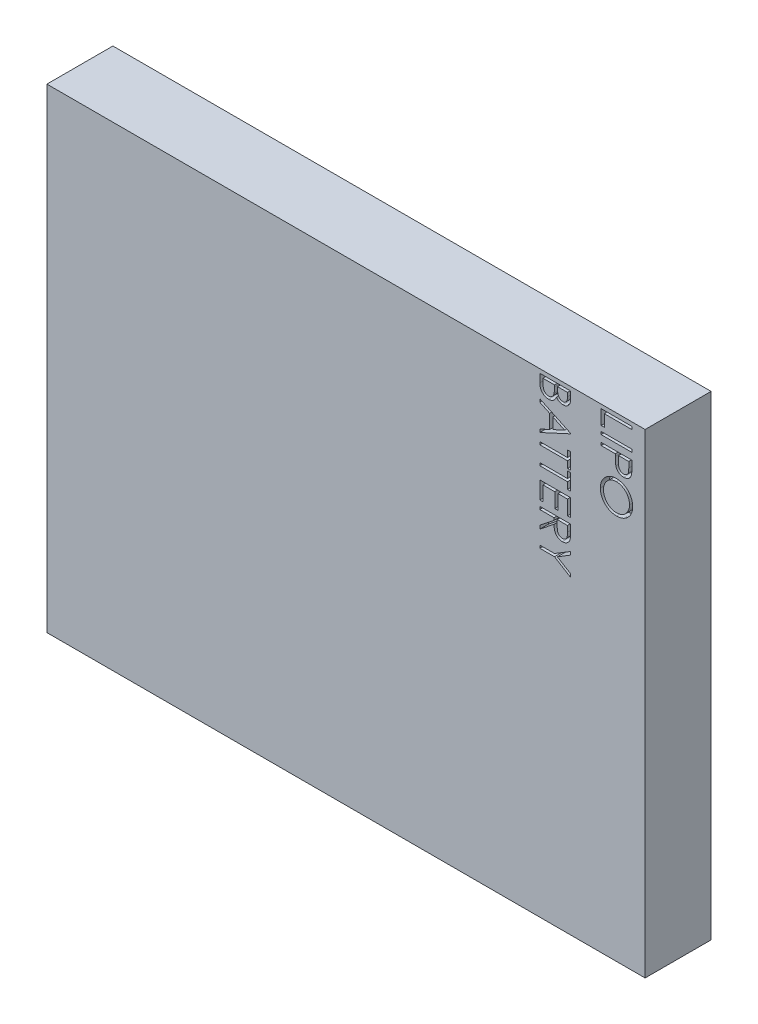
from build123d import *

# Parameters (mm, degrees)
SKETCH1_W           = 68
SKETCH1_H           = 54
BOSS_EXTRUDE1_DEPTH = 7.5
SKETCH2_W           = 3.5
SKETCH2_H           = 0.314102564
CUT_EXTRUDE1_DEPTH  = 1


with BuildPart() as part:
    # Sketch1 → Boss-Extrude1 (new body)
    with BuildSketch(Plane.XY):
        Rectangle(SKETCH1_W, SKETCH1_H)
    extrude(amount=BOSS_EXTRUDE1_DEPTH)

    # Sketch2 → Cut-Extrude1 (cut)
    # profile 1 of 11: a face of its own
    with BuildSketch(Plane.XY.offset(7.5)):
        Polygon((32.5, 26.551282051), (32.5, 26.237179487), (29.358974359, 26.237179487), (29.358974359, 24.891025641), (29, 24.891025641), (29, 26.551282051), align=None)
    # profile 2 of 11: a face of its own
    with BuildSketch(Plane.XY.offset(7.5)):
        with Locations((30.75, 24.150641026)):
            Rectangle(SKETCH2_W, SKETCH2_H)
    # profile 3 of 11: a face of its own
    with BuildSketch(Plane.XY.offset(7.5)):
        with BuildLine():
            Line((32.5, 23.230769231), (32.5, 22.544370994))
            add(Edge.make_bspline(
                [(32.5, 22.544370994), (32.499948104, 22.497160087), (32.499848668, 22.406701895), (32.496833922, 22.276986839), (32.49280723, 22.159177107), (32.487225337, 22.053526726), (32.480628747, 21.959710628), (32.471376708, 21.878153329), (32.461716412, 21.808213772), (32.451895005, 21.766307323), (32.447415865, 21.747195513)],
                knots=[0, 0, 0, 0, 1.415646017, 2.712440637, 3.8905458, 4.950247383, 5.884950622, 6.709939814, 7.411656543, 8, 8, 8, 8], degree=3))
            add(Edge.make_bspline(
                [(32.447415865, 21.747195513), (32.440793975, 21.723001922), (32.42770623, 21.675184832), (32.401491651, 21.606284615), (32.370412659, 21.540727702), (32.334976989, 21.478307484), (32.293734792, 21.419723476), (32.247990678, 21.364225765), (32.197769812, 21.311496032), (32.142098627, 21.26332549), (32.083029703, 21.218978321), (32.019247543, 21.180935178), (31.952140341, 21.148755701), (31.881020836, 21.122474869), (31.806321276, 21.1024913), (31.727823588, 21.087726807), (31.645797497, 21.078280302), (31.589736435, 21.077380918), (31.561197917, 21.076923077)],
                knots=[0, 0, 0, 0, 0.999487232, 1.975422798, 2.933948774, 3.889618007, 4.832992075, 5.786114792, 6.754729845, 7.731954186, 8.717668599, 9.695514499, 10.68728626, 11.680675814, 12.71351902, 13.766008651, 14.862761406, 16, 16, 16, 16], degree=3))
            add(Edge.make_bspline(
                [(31.561197917, 21.076923077), (31.53242014, 21.077344502), (31.476114476, 21.078169048), (31.393741688, 21.088065333), (31.315023298, 21.101395525), (31.240133847, 21.121892577), (31.169518077, 21.14873825), (31.102096845, 21.180230303), (31.039017173, 21.218213833), (30.980050055, 21.261858663), (30.925140143, 21.310410257), (30.874685348, 21.363663195), (30.82898101, 21.421402488), (30.787924666, 21.483444636), (30.752468387, 21.550394485), (30.720711082, 21.621236638), (30.694040021, 21.696586855), (30.68000996, 21.748729369), (30.672876603, 21.775240385)],
                knots=[0, 0, 0, 0, 1.121902311, 2.195077645, 3.232258892, 4.234102512, 5.217864754, 6.176164875, 7.132989551, 8.084763148, 9.034132444, 9.988522005, 10.94243251, 11.903244335, 12.886203696, 13.894208494, 14.929344452, 16, 16, 16, 16], degree=3))
            add(Edge.make_bspline(
                [(30.672876603, 21.775240385), (30.668213621, 21.797167719), (30.657994427, 21.845222746), (30.64658597, 21.924365468), (30.63684837, 22.016510854), (30.629547232, 22.121533134), (30.623296864, 22.239338039), (30.61832877, 22.369989296), (30.615598916, 22.513743373), (30.615458123, 22.614014617), (30.615384615, 22.666366186)],
                knots=[0, 0, 0, 0, 0.601384939, 1.31797006, 2.144135048, 3.087295005, 4.142315834, 5.309527816, 6.595305764, 8, 8, 8, 8], degree=3))
            Line((30.615384615, 22.666366186), (30.615384615, 22.916666667))
            Line((30.615384615, 22.916666667), (29, 22.916666667))
            Line((29, 22.916666667), (29, 23.230769231))
            Line((29, 23.230769231), (32.5, 23.230769231))
        make_face()
        with BuildLine():
            Line((32.141025641, 22.916666667), (30.974358974, 22.916666667))
            Line((30.974358974, 22.916666667), (30.966646635, 22.303886218))
            add(Edge.make_bspline(
                [(30.966646635, 22.303886218), (30.966627924, 22.273966), (30.966591804, 22.216205635), (30.970631709, 22.132540305), (30.975087995, 22.055117307), (30.982066731, 21.983768505), (30.99126187, 21.919039151), (31.001270604, 21.860097819), (31.014830447, 21.807807378), (31.033737491, 21.746532557), (31.065355346, 21.67848546), (31.112432024, 21.604948929), (31.170792088, 21.541618988), (31.237310672, 21.487182148), (31.311578922, 21.444993742), (31.390418136, 21.413262681), (31.473877922, 21.39477952), (31.530961719, 21.392285441), (31.559795673, 21.391025641)],
                knots=[0, 0, 0, 0, 1.160368111, 2.240066715, 3.248291599, 4.168343349, 5.019594299, 5.784185847, 6.485545725, 7.113397927, 8.269509094, 9.383373363, 10.487084095, 11.595623793, 12.704274681, 13.786671823, 14.88201193, 16, 16, 16, 16], degree=3))
            add(Edge.make_bspline(
                [(31.559795673, 21.391025641), (31.587932, 21.392292168), (31.643863535, 21.394809868), (31.725874557, 21.413408474), (31.803877317, 21.444931799), (31.877231232, 21.487468023), (31.943477588, 21.540341808), (32.000520555, 21.602268299), (32.047000556, 21.671982998), (32.076793746, 21.736866185), (32.095014888, 21.794462256), (32.107758306, 21.844495455), (32.117934363, 21.900985737), (32.126173726, 21.963953638), (32.133227231, 22.032910435), (32.138013195, 22.108448761), (32.140814655, 22.190282401), (32.14095361, 22.247092972), (32.141025641, 22.276542468)],
                knots=[0, 0, 0, 0, 1.120550889, 2.227516482, 3.330715807, 4.461473166, 5.594337325, 6.694900473, 7.802844763, 8.919519911, 9.52614448, 10.208195984, 10.975273469, 11.811520316, 12.738076669, 13.736566072, 14.826679847, 16, 16, 16, 16], degree=3))
            Line((32.141025641, 22.276542468), (32.141025641, 22.916666667))
        make_face(mode=Mode.SUBTRACT)
    # profile 4 of 11: a face of its own
    with BuildSketch(Plane.XY.offset(7.5)):
        with BuildLine():
            add(Edge.make_bspline(
                [(32.58974359, 18.721153846), (32.588102095, 18.656345753), (32.584878065, 18.529057312), (32.560199174, 18.341982229), (32.517503005, 18.163387812), (32.460642864, 17.991815197), (32.384777986, 17.829331367), (32.293132169, 17.674658191), (32.184401996, 17.528232989), (32.060411907, 17.391397925), (31.925013874, 17.266640545), (31.780103223, 17.157640882), (31.627664278, 17.06548249), (31.467166593, 16.989946718), (31.299316575, 16.930634605), (31.123159859, 16.889719244), (30.93985391, 16.863580087), (30.814826943, 16.860524448), (30.751402244, 16.858974359)],
                knots=[0, 0, 0, 0, 1.06508495, 2.091914715, 3.094501328, 4.079693967, 5.057647778, 6.035986298, 7.030177474, 8.050107388, 9.066943579, 10.051896531, 11.025616101, 11.9896488, 12.96281505, 13.945825876, 14.957941789, 16, 16, 16, 16], degree=3))
            add(Edge.make_bspline(
                [(30.751402244, 16.858974359), (30.688444743, 16.860524219), (30.564348215, 16.863579172), (30.38220555, 16.889748994), (30.207111995, 16.930786159), (30.039376849, 16.989396523), (29.878760099, 17.064569421), (29.726040956, 17.157350669), (29.580126929, 17.265628684), (29.444071601, 17.389954851), (29.319069137, 17.525320595), (29.209900008, 17.670639884), (29.116606927, 17.822928806), (29.041589249, 17.983329467), (28.981857369, 18.150053666), (28.941093859, 18.324629423), (28.91480978, 18.506277766), (28.911790855, 18.630148523), (28.91025641, 18.693108974)],
                knots=[0, 0, 0, 0, 1.04355943, 2.056976533, 3.044937463, 4.02179873, 4.997890911, 5.980248884, 6.980147982, 8.006253959, 9.032111064, 10.031228745, 11.015595249, 11.988180414, 12.962670953, 13.946861971, 14.95644057, 16, 16, 16, 16], degree=3))
            add(Edge.make_bspline(
                [(28.91025641, 18.693108974), (28.911805589, 18.756533417), (28.914859433, 18.881559878), (28.94104382, 19.065095135), (28.98197419, 19.2413794), (29.040523622, 19.409869896), (29.115907025, 19.570621915), (29.208542033, 19.723619909), (29.317699667, 19.86904773), (29.44186031, 20.005425481), (29.577291109, 20.13005631), (29.721655207, 20.23967632), (29.873579619, 20.331777268), (30.032438084, 20.407192494), (30.197819979, 20.466843066), (30.370765619, 20.507551654), (30.550305895, 20.533886583), (30.672548687, 20.53692157), (30.734575321, 20.538461538)],
                knots=[0, 0, 0, 0, 1.053167129, 2.076072758, 3.073341244, 4.055601477, 5.033424535, 6.017524495, 7.021518915, 8.049444456, 9.077120685, 10.074910483, 11.055688766, 12.022980584, 12.991883888, 13.970269434, 14.970104079, 16, 16, 16, 16], degree=3))
            add(Edge.make_bspline(
                [(30.734575321, 20.538461538), (30.77620818, 20.537927393), (30.858948682, 20.536865841), (30.981812482, 20.524066936), (31.102713633, 20.505532268), (31.221245722, 20.478830238), (31.337428106, 20.444386885), (31.451023186, 20.401941294), (31.562966651, 20.353298631), (31.671128018, 20.295382822), (31.775677054, 20.23219494), (31.875306461, 20.163294905), (31.968236589, 20.088202311), (32.055960675, 20.00798984), (32.136981469, 19.921547171), (32.21306541, 19.830175263), (32.283424907, 19.733396018), (32.346582215, 19.631056376), (32.40459297, 19.525765526), (32.453027176, 19.416759577), (32.49583652, 19.306338444), (32.529857253, 19.193529497), (32.556931155, 19.07859368), (32.575327187, 18.96138731), (32.588154532, 18.842031109), (32.589211625, 18.761619625), (32.58974359, 18.721153846)],
                knots=[0, 0, 0, 0, 1.037115869, 2.061148057, 3.07517727, 4.084041727, 5.086514338, 6.092668487, 7.104487461, 8.125783165, 9.147610153, 10.147694368, 11.141876323, 12.122903372, 13.107606018, 14.091946891, 15.084523921, 16.086505767, 17.087268121, 18.077809654, 19.05670789, 20.036870126, 21.011670792, 21.99694167, 22.991993299, 24, 24, 24, 24], degree=3))
        make_face()
        with BuildLine():
            add(Edge.make_bspline(
                [(32.230769231, 18.705729167), (32.230364533, 18.738943876), (32.229559007, 18.80505576), (32.218940442, 18.903339175), (32.203821283, 19.00033533), (32.182199728, 19.096038945), (32.153011412, 19.189935004), (32.118619208, 19.282961185), (32.078161992, 19.37467081), (32.030987871, 19.464038631), (31.979455267, 19.550915268), (31.922896448, 19.633455302), (31.861585665, 19.710835339), (31.796332792, 19.783303257), (31.726473906, 19.850647883), (31.653123961, 19.914234341), (31.574171398, 19.971503449), (31.491761173, 20.023989154), (31.405999543, 20.07095696), (31.317789694, 20.112722324), (31.226412003, 20.14688633), (31.132857847, 20.174748707), (31.037275387, 20.197848518), (30.938939538, 20.212482442), (30.838344426, 20.223214801), (30.770362572, 20.223974647), (30.735977564, 20.224358974)],
                knots=[0, 0, 0, 0, 1.008585988, 2.007529826, 2.999688727, 3.990042337, 4.984966365, 5.984641633, 7.001812546, 8.027570247, 9.052811818, 10.068991095, 11.064725446, 12.050001529, 13.029093193, 14.010961114, 14.996492974, 15.989185205, 16.977398719, 17.96520407, 18.951579521, 19.937648295, 20.929603947, 21.935788061, 22.955928099, 24, 24, 24, 24], degree=3))
            add(Edge.make_bspline(
                [(30.735977564, 20.224358974), (30.685415343, 20.223084112), (30.585943813, 20.220576065), (30.440175669, 20.198618494), (30.300087383, 20.16479652), (30.166445474, 20.114939154), (30.038101191, 20.052588539), (29.916193086, 19.975561649), (29.800688212, 19.884302563), (29.692392943, 19.780639036), (29.593547138, 19.66731633), (29.50678373, 19.5469836), (29.43337348, 19.420929992), (29.373568408, 19.28882679), (29.32617867, 19.151379251), (29.293700039, 19.0077017), (29.272324583, 18.85875124), (29.270271827, 18.757220585), (29.269230769, 18.705729167)],
                knots=[0, 0, 0, 0, 1.032063989, 2.030389145, 3.003944642, 3.970395727, 4.937377036, 5.913328081, 6.909231446, 7.93887556, 8.970685674, 9.976071282, 10.964166581, 11.944589148, 12.933237628, 13.927779006, 14.949070134, 16, 16, 16, 16], degree=3))
            add(Edge.make_bspline(
                [(29.269230769, 18.705729167), (29.269706272, 18.671119664), (29.270649337, 18.602478626), (29.280148035, 18.500383118), (29.295379827, 18.400126852), (29.317310768, 18.301850773), (29.34475692, 18.205665219), (29.377368571, 18.111173178), (29.418035002, 18.019364487), (29.46303868, 17.929143885), (29.513974143, 17.84276911), (29.569742383, 17.760820437), (29.62995669, 17.683772955), (29.694642917, 17.611459785), (29.76324345, 17.543648535), (29.837522123, 17.482180566), (29.915309656, 17.424225383), (29.997912104, 17.371949837), (30.083854458, 17.325075411), (30.172398435, 17.284315191), (30.263239739, 17.249714052), (30.356532336, 17.2217869), (30.452092907, 17.199901073), (30.550051061, 17.184821252), (30.650210383, 17.174272787), (30.717954242, 17.173477713), (30.752103365, 17.173076923)],
                knots=[0, 0, 0, 0, 1.047226202, 2.076964084, 3.100341814, 4.114585567, 5.122123135, 6.126552355, 7.137064942, 8.158803602, 9.176592812, 10.169297945, 11.156925011, 12.133779169, 13.104132798, 14.073170763, 15.049307625, 16.038276215, 17.028988595, 18.010110019, 18.986169996, 19.968539974, 20.955178716, 21.950601663, 22.966915103, 24, 24, 24, 24], degree=3))
            add(Edge.make_bspline(
                [(30.752103365, 17.173076923), (30.78601887, 17.173478036), (30.85329652, 17.174273718), (30.952757338, 17.184816192), (31.05001055, 17.199917083), (31.144674353, 17.221679791), (31.236772878, 17.249729944), (31.326219625, 17.284317275), (31.413347821, 17.325102574), (31.497942117, 17.371910799), (31.579116856, 17.424526622), (31.656719267, 17.482020865), (31.729292011, 17.545386213), (31.798626696, 17.612812241), (31.863244622, 17.685983115), (31.923167004, 17.764567449), (31.979840805, 17.847610976), (32.030964348, 17.935538789), (32.078186141, 18.026280579), (32.118609301, 18.119402506), (32.153160153, 18.21401278), (32.182080254, 18.309627002), (32.203842466, 18.406918734), (32.218935017, 18.505321407), (32.229560144, 18.605003216), (32.230364923, 18.672047304), (32.230769231, 18.705729167)],
                knots=[0, 0, 0, 0, 1.029967493, 2.04313025, 3.035375922, 4.01889446, 4.991458755, 5.958017022, 6.930036849, 7.912118993, 8.892942568, 9.867138445, 10.843712051, 11.817804417, 12.803729339, 13.806387533, 14.818654169, 15.856205545, 16.894655496, 17.924916651, 18.938004761, 19.953404357, 20.957695443, 21.963967554, 22.97713031, 24, 24, 24, 24], degree=3))
        make_face(mode=Mode.SUBTRACT)
    # profile 5 of 11: a face of its own
    with BuildSketch(Plane.XY.offset(7.5)):
        with BuildLine():
            Line((25.532051282, 26.551282051), (25.532051282, 25.868389423))
            add(Edge.make_bspline(
                [(25.532051282, 25.868389423), (25.531875532, 25.834960945), (25.531534884, 25.770168235), (25.526251752, 25.675948793), (25.519048083, 25.587699982), (25.50761799, 25.50539621), (25.493826213, 25.429075507), (25.477124397, 25.35850787), (25.457097783, 25.293917698), (25.425251502, 25.216804961), (25.377928333, 25.128884301), (25.307999768, 25.033685908), (25.222467305, 24.952281668), (25.12598465, 24.882095351), (25.019848878, 24.826294232), (24.906589689, 24.785924934), (24.787667947, 24.760367059), (24.706024769, 24.757738625), (24.664763622, 24.756410256)],
                knots=[0, 0, 0, 0, 1.001505555, 1.941167018, 2.826882275, 3.653841531, 4.429895133, 5.150066043, 5.825578002, 6.45369114, 7.647487171, 8.808567382, 9.977351308, 11.170798116, 12.373658725, 13.556498008, 14.765093433, 16, 16, 16, 16], degree=3))
            add(Edge.make_bspline(
                [(24.664763622, 24.756410256), (24.626104517, 24.757482346), (24.55013573, 24.759589104), (24.439201962, 24.780420756), (24.33316741, 24.811436115), (24.233339263, 24.856461252), (24.141000529, 24.914377511), (24.056699972, 24.984073044), (23.982480546, 25.067054688), (23.941160823, 25.129326349), (23.920172276, 25.160957532)],
                knots=[0, 0, 0, 0, 1.044266239, 2.052081639, 3.041743201, 4.026043445, 5.00270663, 5.980942822, 6.97441044, 8, 8, 8, 8], degree=3))
            add(Edge.make_bspline(
                [(23.920172276, 25.160957532), (23.904919057, 25.121190446), (23.87573587, 25.045106158), (23.823859601, 24.940328843), (23.768072332, 24.84969414), (23.706827388, 24.773102288), (23.639986314, 24.708585505), (23.568887566, 24.650648095), (23.490030852, 24.602109535), (23.405661562, 24.560410821), (23.316371843, 24.52759437), (23.222570049, 24.504374577), (23.125305056, 24.490107145), (23.05900908, 24.488161638), (23.025540865, 24.487179487)],
                knots=[0, 0, 0, 0, 1.272302504, 2.434229863, 3.488457646, 4.447234501, 5.35599188, 6.26022912, 7.18267843, 8.11661068, 9.06895546, 10.019249207, 11.000057067, 12, 12, 12, 12], degree=3))
            add(Edge.make_bspline(
                [(23.025540865, 24.487179487), (22.991374187, 24.48815664), (22.92415029, 24.490079215), (22.825392388, 24.504254808), (22.731027611, 24.528280008), (22.640385012, 24.561291945), (22.553977659, 24.604621478), (22.470723373, 24.656215661), (22.392839992, 24.71901232), (22.318475363, 24.789008086), (22.25165199, 24.86828582), (22.192160634, 24.95380788), (22.143010645, 25.046804355), (22.102239528, 25.145833114), (22.070642121, 25.251552208), (22.048705735, 25.363569654), (22.033890555, 25.481909797), (22.032674776, 25.563120133), (22.032051282, 25.604767628)],
                knots=[0, 0, 0, 0, 0.978404568, 1.925038397, 2.85041836, 3.763147166, 4.682162379, 5.614488577, 6.562659439, 7.54271123, 8.535210642, 9.526693784, 10.520907202, 11.541451354, 12.589717429, 13.675358278, 14.807842563, 16, 16, 16, 16], degree=3))
            Line((22.032051282, 25.604767628), (22.032051282, 26.551282051))
            Line((22.032051282, 26.551282051), (25.532051282, 26.551282051))
        make_face()
        with BuildLine():
            Line((25.173076923, 26.237179487), (24.051282051, 26.237179487))
            Line((24.051282051, 26.237179487), (24.051282051, 26.026141827))
            add(Edge.make_bspline(
                [(24.051282051, 26.026141827), (24.051678646, 25.995292754), (24.052444949, 25.935686058), (24.054709227, 25.849136767), (24.060771665, 25.768999448), (24.067183693, 25.694997963), (24.077056904, 25.627628301), (24.08913894, 25.566664928), (24.101805091, 25.511560202), (24.123406294, 25.448041233), (24.155006925, 25.376011565), (24.205201705, 25.299713252), (24.263363291, 25.231357988), (24.331711856, 25.174282204), (24.406333347, 25.127184705), (24.487234416, 25.095753879), (24.571256713, 25.073460407), (24.629090183, 25.071505414), (24.658453526, 25.070512821)],
                knots=[0, 0, 0, 0, 1.156481963, 2.23455883, 3.244418989, 4.168404366, 5.01828131, 5.794834307, 6.498111525, 7.13526334, 8.307595709, 9.435046769, 10.546766856, 11.659452936, 12.760769924, 13.837671619, 14.902137667, 16, 16, 16, 16], degree=3))
            add(Edge.make_bspline(
                [(24.658453526, 25.070512821), (24.677888446, 25.071009258), (24.716012166, 25.071983075), (24.771373698, 25.080845965), (24.824107511, 25.093706105), (24.873000762, 25.113797567), (24.919443139, 25.138092298), (24.961371824, 25.169695334), (25.00108392, 25.205385876), (25.037121297, 25.247300944), (25.069410929, 25.295237583), (25.097822972, 25.34965254), (25.120235205, 25.411195559), (25.14034017, 25.47847122), (25.154290825, 25.552556211), (25.165955431, 25.63272662), (25.171884873, 25.719662558), (25.17267071, 25.779807486), (25.173076923, 25.810897436)],
                knots=[0, 0, 0, 0, 0.911752476, 1.788502045, 2.626783689, 3.45400582, 4.26402138, 5.080402872, 5.911472738, 6.767166405, 7.66795952, 8.620018292, 9.640966946, 10.73819047, 11.913090943, 13.176185384, 14.540321519, 16, 16, 16, 16], degree=3))
            Line((25.173076923, 25.810897436), (25.173076923, 26.237179487))
        make_face(mode=Mode.SUBTRACT)
        with BuildLine():
            Line((23.692307692, 26.237179487), (22.391025641, 26.237179487))
            Line((22.391025641, 26.237179487), (22.391025641, 25.789863782))
            add(Edge.make_bspline(
                [(22.391025641, 25.789863782), (22.391408048, 25.757844697), (22.392145087, 25.696132133), (22.394577481, 25.607033016), (22.399994061, 25.524674648), (22.40882453, 25.449009637), (22.418000157, 25.379371925), (22.430699669, 25.316453365), (22.445137478, 25.260157497), (22.467480672, 25.194889307), (22.50213197, 25.121345941), (22.554719024, 25.04214714), (22.616543443, 24.971029869), (22.688999386, 24.911330481), (22.767186367, 24.862033068), (22.850695442, 24.827457915), (22.936978998, 24.805226588), (22.995960815, 24.802599544), (23.025540865, 24.801282051)],
                knots=[0, 0, 0, 0, 1.159821618, 2.235403267, 3.228114831, 4.14795534, 4.994323282, 5.771256229, 6.471395042, 7.097801288, 8.267864287, 9.404187171, 10.531774336, 11.667624178, 12.792825787, 13.866573821, 14.930062559, 16, 16, 16, 16], degree=3))
            add(Edge.make_bspline(
                [(23.025540865, 24.801282051), (23.044036598, 24.801551343), (23.080729727, 24.802085582), (23.134610664, 24.810445523), (23.187036255, 24.822108186), (23.237213747, 24.838996725), (23.285959635, 24.860291804), (23.332424842, 24.88701632), (23.377720369, 24.917878073), (23.434918354, 24.966156052), (23.50084258, 25.036310943), (23.565377671, 25.136023434), (23.617426159, 25.249394118), (23.639525538, 25.331621841), (23.650941506, 25.374098558)],
                knots=[0, 0, 0, 0, 0.723503378, 1.435336582, 2.130201219, 2.824764462, 3.504949994, 4.209866579, 4.920640069, 5.648298893, 7.13757748, 8.670694625, 10.280166878, 12, 12, 12, 12], degree=3))
            add(Edge.make_bspline(
                [(23.650941506, 25.374098558), (23.654396823, 25.391127638), (23.661888661, 25.428050196), (23.669791898, 25.488258082), (23.676881359, 25.557224435), (23.681987752, 25.634654481), (23.687469375, 25.720856169), (23.689525319, 25.815801805), (23.692034706, 25.919558513), (23.692214369, 25.991550974), (23.692307692, 26.028946314)],
                knots=[0, 0, 0, 0, 0.634452549, 1.375623993, 2.216454381, 3.166361212, 4.209414599, 5.370755378, 6.634280627, 8, 8, 8, 8], degree=3))
            Line((23.692307692, 26.028946314), (23.692307692, 26.237179487))
        make_face(mode=Mode.SUBTRACT)
    # profile 6 of 11: a face of its own
    with BuildSketch(Plane.XY.offset(7.5)):
        Polygon((25.532051282, 22.333333333), (22.032051282, 20.717948718), (22.032051282, 21.059395032), (23.153846154, 21.576822917), (23.153846154, 23.163461538), (22.032051282, 23.695612981), (22.032051282, 24.038461538), (25.532051282, 22.378205128), align=None)
        Polygon((24.849859776, 22.35927484), (23.512820513, 22.993088942), (23.512820513, 21.74228766), align=None, mode=Mode.SUBTRACT)
    # profile 7 of 11: a face of its own
    with BuildSketch(Plane.XY.offset(7.5)):
        Polygon((25.173076923, 20.583333333), (25.532051282, 20.583333333), (25.532051282, 18.743589744), (25.173076923, 18.743589744), (25.173076923, 19.506410256), (22.032051282, 19.506410256), (22.032051282, 19.820512821), (25.173076923, 19.820512821), align=None)
    # profile 8 of 11: a face of its own
    with BuildSketch(Plane.XY.offset(7.5)):
        Polygon((25.173076923, 18.519230769), (25.532051282, 18.519230769), (25.532051282, 16.679487179), (25.173076923, 16.679487179), (25.173076923, 17.442307692), (22.032051282, 17.442307692), (22.032051282, 17.756410256), (25.173076923, 17.756410256), align=None)
    # profile 9 of 11: a face of its own
    with BuildSketch(Plane.XY.offset(7.5)):
        Polygon((25.532051282, 16.051282051), (25.532051282, 14.076923077), (25.173076923, 14.076923077), (25.173076923, 15.737179487), (24.096153846, 15.737179487), (24.096153846, 14.076923077), (23.737179487, 14.076923077), (23.737179487, 15.737179487), (22.391025641, 15.737179487), (22.391025641, 14.076923077), (22.032051282, 14.076923077), (22.032051282, 16.051282051), align=None)
    # profile 10 of 11: a face of its own
    with BuildSketch(Plane.XY.offset(7.5)):
        with BuildLine():
            Line((25.532051282, 13.448717949), (25.532051282, 12.748297276))
            add(Edge.make_bspline(
                [(25.532051282, 12.748297276), (25.531895696, 12.701556147), (25.531596954, 12.611808003), (25.529931191, 12.483234732), (25.525156835, 12.366407635), (25.521048252, 12.261387796), (25.51355631, 12.168177141), (25.506395663, 12.08648985), (25.497022002, 12.016702153), (25.488316579, 11.974456302), (25.484375, 11.955328526)],
                knots=[0, 0, 0, 0, 1.410062039, 2.707475311, 3.878576406, 4.937260626, 5.877586885, 6.699081471, 7.410979367, 8, 8, 8, 8], degree=3))
            add(Edge.make_bspline(
                [(25.484375, 11.955328526), (25.478048952, 11.92972145), (25.465531809, 11.879053569), (25.439061795, 11.806110046), (25.408480587, 11.736571581), (25.372283029, 11.67069913), (25.331100485, 11.608486583), (25.28469234, 11.550027089), (25.232822256, 11.495654878), (25.176814776, 11.444951581), (25.116181219, 11.398990674), (25.051804849, 11.359217523), (24.984088305, 11.325159974), (24.912795772, 11.297970808), (24.838529912, 11.276097957), (24.760642242, 11.260670305), (24.679480956, 11.251419508), (24.62412309, 11.250477599), (24.596053686, 11.25)],
                knots=[0, 0, 0, 0, 1.02737288, 2.032829108, 3.019628684, 3.985738875, 4.958353778, 5.924249254, 6.890702889, 7.883913451, 8.865824512, 9.85161466, 10.829249435, 11.81541824, 12.821369441, 13.843154991, 14.906364023, 16, 16, 16, 16], degree=3))
            add(Edge.make_bspline(
                [(24.596053686, 11.25), (24.549418528, 11.25146896), (24.458421255, 11.254335281), (24.326361123, 11.281060918), (24.203169067, 11.32483549), (24.089016528, 11.385165953), (23.986068508, 11.461958877), (23.895951736, 11.554246509), (23.819844016, 11.661557543), (23.767627413, 11.761926098), (23.734029012, 11.850628482), (23.71027038, 11.923868152), (23.692223403, 12.003820916), (23.675821223, 12.08933973), (23.663305041, 12.18108515), (23.654416174, 12.278872424), (23.648700564, 12.382946123), (23.647865489, 12.454285885), (23.647435897, 12.490985577)],
                knots=[0, 0, 0, 0, 1.260402266, 2.459371274, 3.627181936, 4.786749125, 5.93865593, 7.087644312, 8.261344208, 9.485713728, 10.136162886, 10.825977872, 11.566646758, 12.35154167, 13.181268117, 14.0701832, 15.007234106, 16, 16, 16, 16], degree=3))
            Line((23.647435897, 12.490985577), (22.032051282, 11.205128205))
            Line((22.032051282, 11.205128205), (22.032051282, 11.593549679))
            Line((22.032051282, 11.593549679), (23.647435897, 12.879407051))
            Line((23.647435897, 12.879407051), (23.647435897, 13.134615385))
            Line((23.647435897, 13.134615385), (22.032051282, 13.134615385))
            Line((22.032051282, 13.134615385), (22.032051282, 13.448717949))
            Line((22.032051282, 13.448717949), (25.532051282, 13.448717949))
        make_face()
        with BuildLine():
            Line((25.173076923, 13.134615385), (24.006410256, 13.134615385))
            Line((24.006410256, 13.134615385), (24.001502404, 12.493790064))
            add(Edge.make_bspline(
                [(24.001502404, 12.493790064), (24.001489167, 12.463870025), (24.001463511, 12.405876468), (24.005457286, 12.321975802), (24.010000609, 12.243855696), (24.01694994, 12.171814925), (24.02590606, 12.105821412), (24.037108886, 12.045907794), (24.050161462, 11.99197741), (24.070360925, 11.929076058), (24.102381564, 11.858858543), (24.148889718, 11.7824525), (24.207765343, 11.717607326), (24.274018708, 11.661698219), (24.348361095, 11.618633966), (24.427492725, 11.587290746), (24.510730429, 11.567621128), (24.567902272, 11.565282689), (24.596754808, 11.564102564)],
                knots=[0, 0, 0, 0, 1.14660753, 2.222451964, 3.218720504, 4.145691244, 4.995719623, 5.770487122, 6.480909919, 7.121111896, 8.299844659, 9.430703709, 10.534634535, 11.641396424, 12.741395289, 13.810956493, 14.895269934, 16, 16, 16, 16], degree=3))
            add(Edge.make_bspline(
                [(24.596754808, 11.564102564), (24.624909187, 11.565286316), (24.680700893, 11.567632082), (24.76215433, 11.587328856), (24.839581191, 11.619136268), (24.91150567, 11.66373762), (24.977337662, 11.717631513), (25.032886579, 11.781638525), (25.079405559, 11.852535184), (25.108915703, 11.918845406), (25.127044253, 11.978073562), (25.139785417, 12.029505669), (25.150108265, 12.087840439), (25.158134085, 12.15293807), (25.165356406, 12.224680791), (25.170039167, 12.303265047), (25.172869429, 12.38860009), (25.173006149, 12.447747272), (25.173076923, 12.478365385)],
                knots=[0, 0, 0, 0, 1.100801541, 2.181386982, 3.260112282, 4.364594493, 5.481957178, 6.577424609, 7.668452592, 8.790448866, 9.403819393, 10.091598921, 10.863153553, 11.720938239, 12.658472417, 13.685008818, 14.801622349, 16, 16, 16, 16], degree=3))
            Line((25.173076923, 12.478365385), (25.173076923, 13.134615385))
        make_face(mode=Mode.SUBTRACT)
    # profile 11 of 11: a face of its own
    with BuildSketch(Plane.XY.offset(7.5)):
        Polygon((25.532051282, 10.756410256), (25.532051282, 10.396734776), (24.028145032, 9.476862981), (25.532051282, 8.558393429), (25.532051282, 8.198717949), (23.695813301, 9.320512821), (22.032051282, 9.320512821), (22.032051282, 9.634615385), (23.695813301, 9.634615385), align=None)
    extrude(amount=-CUT_EXTRUDE1_DEPTH, mode=Mode.SUBTRACT)


solid = part.part
